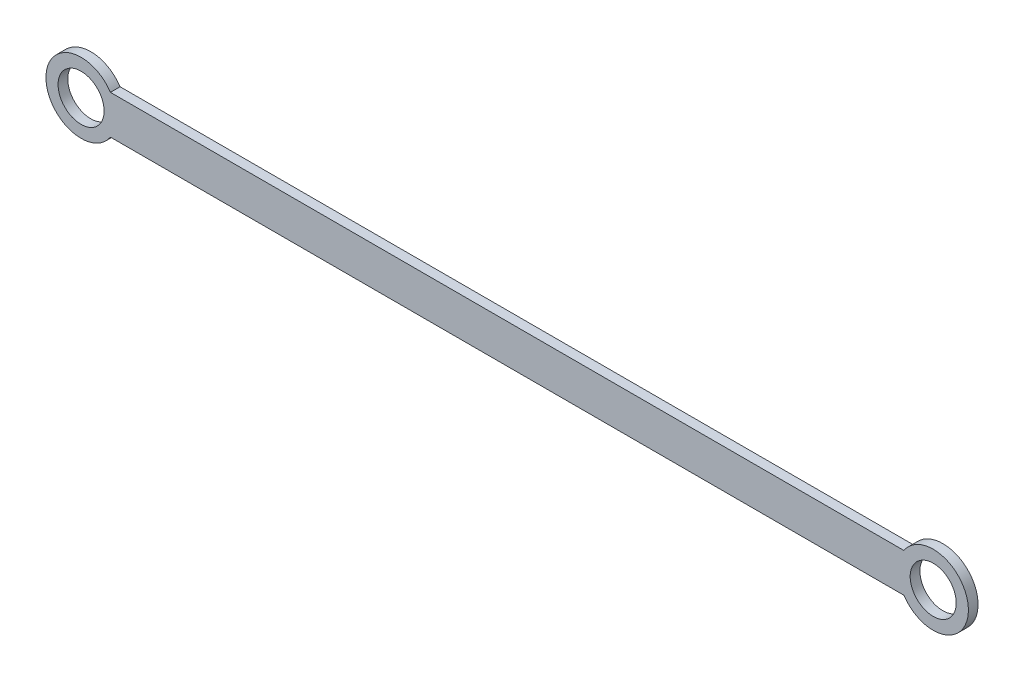
from build123d import *

# Parameters (mm, degrees)
SKETCH_1_R      = 9.5
EXTRUDE_1_DEPTH = 4


with BuildPart() as part:
    # 草图1 → 凸台-拉伸1 (new body)
    with BuildSketch(Plane.XY):
        with BuildLine():
            Line((12.093386622, 8), (339.397537141, 8))
            ThreePointArc((339.397537141, 8), (365.990923763, 0), (339.397537141, -8))
            Line((339.397537141, -8), (12.093386622, -8))
            ThreePointArc((12.093386622, -8), (-14.5, 0), (12.093386622, 8))
        make_face()
        Circle(SKETCH_1_R, mode=Mode.SUBTRACT)
        with Locations((351.490923763, 0)):
            Circle(SKETCH_1_R, mode=Mode.SUBTRACT)
    extrude(amount=EXTRUDE_1_DEPTH)


solid = part.part
